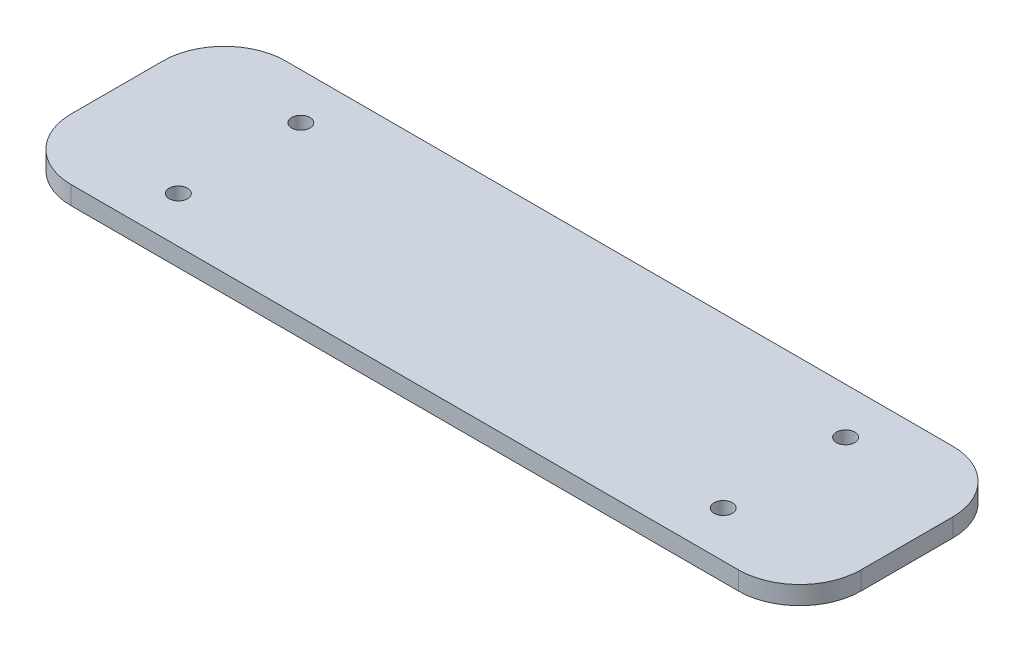
from build123d import *

# Parameters (mm, degrees)
SKETCH_1_W      = 129
SKETCH_1_H      = 35
SKETCH_1_R      = 1.5
EXTRUDE_1_DEPTH = 3
FILLET_1_R      = 10


with BuildPart() as part:
    # 草圖1 → 填料-伸長1 (new body)
    with BuildSketch(Plane(origin=(0, 0, 0), x_dir=(1, 0, 0), z_dir=(0, 1, 0))):
        Rectangle(SKETCH_1_W, SKETCH_1_H)
        with Locations(Location((-44.5, 10, 0), (0, 0, 270))):
            Circle(SKETCH_1_R, mode=Mode.SUBTRACT)
        with Locations(Location((-44.5, -10, 0), (0, 0, 270))):
            Circle(SKETCH_1_R, mode=Mode.SUBTRACT)
        with Locations(Location((44.5, -10, 0), (0, 0, 270))):
            Circle(SKETCH_1_R, mode=Mode.SUBTRACT)
        with Locations(Location((44.5, 10, 0), (0, 0, 270))):
            Circle(SKETCH_1_R, mode=Mode.SUBTRACT)
    extrude(amount=EXTRUDE_1_DEPTH)

    # 圓角1
    fillet_1_edges = [part.edges().sort_by_distance(p)[0] for p in [
        (64.5, 1.5, 17.5),
        (-64.5, 1.5, 17.5),
        (-64.5, 1.5, -17.5),
        (64.5, 1.5, -17.5),
    ]]
    fillet(fillet_1_edges, radius=FILLET_1_R)


solid = part.part
